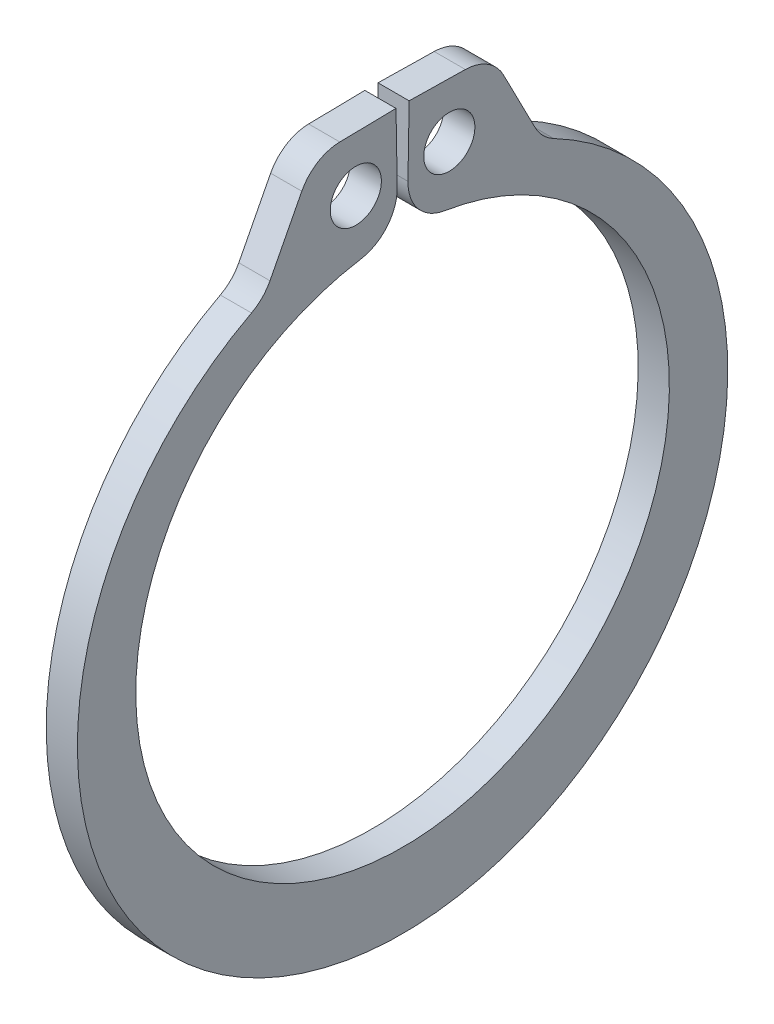
from build123d import *

# Parameters (mm, degrees)
BOSS_EXTRUDE1_DEPTH      = 0.3175
BOSS_EXTRUDE1_DEPTH_BACK = 0.3175
SKETCH3_R                = 0.5207
FILLET1_R                = 0.889


with BuildPart() as part:
    # Sketch3 → Boss-Extrude1 (new, two sides: drawn at the far end of the back side and taken through both)
    with BuildSketch(Plane(origin=(0, 0, 0), x_dir=(0, 0, -1), z_dir=(1, 0, 0)).offset(-BOSS_EXTRUDE1_DEPTH_BACK)):
        with BuildLine():
            Line((-1.810018595, 7.640374486), (-2.834582122, 5.653822543))
            ThreePointArc((-2.834582122, 5.653822543), (0, -6.9596), (2.834582122, 5.653822543))
            Line((2.834582122, 5.653822543), (1.810018595, 7.640374486))
            Line((1.810018595, 7.640374486), (0.133873919, 7.6696317))
            Line((0.133873919, 7.6696317), (0.0948643, 5.434772132))
            ThreePointArc((0.0948643, 5.434772132), (0, -5.4356), (-0.0948643, 5.434772132))
            Line((-0.0948643, 5.434772132), (-0.133873919, 7.6696317))
            Line((-0.133873919, 7.6696317), (-1.810018595, 7.640374486))
        make_face()
        with Locations((-0.952441448, 6.537573309)):
            Circle(SKETCH3_R, mode=Mode.SUBTRACT)
        with Locations((0.952441448, 6.537573309)):
            Circle(SKETCH3_R, mode=Mode.SUBTRACT)
    extrude(amount=BOSS_EXTRUDE1_DEPTH + BOSS_EXTRUDE1_DEPTH_BACK)

    # Fillet1
    fillet1_edges = [part.edges().sort_by_distance(p)[0] for p in [
        (0, 5.653822543, 2.834582122),
        (0, 7.640374486, 1.810018595),
        (0, 5.434772132, 0.0948643),
        (0, 5.434772132, -0.0948643),
        (0, 7.640374486, -1.810018595),
        (0, 5.653822543, -2.834582122),
    ]]
    fillet(fillet1_edges, radius=FILLET1_R)


solid = part.part
